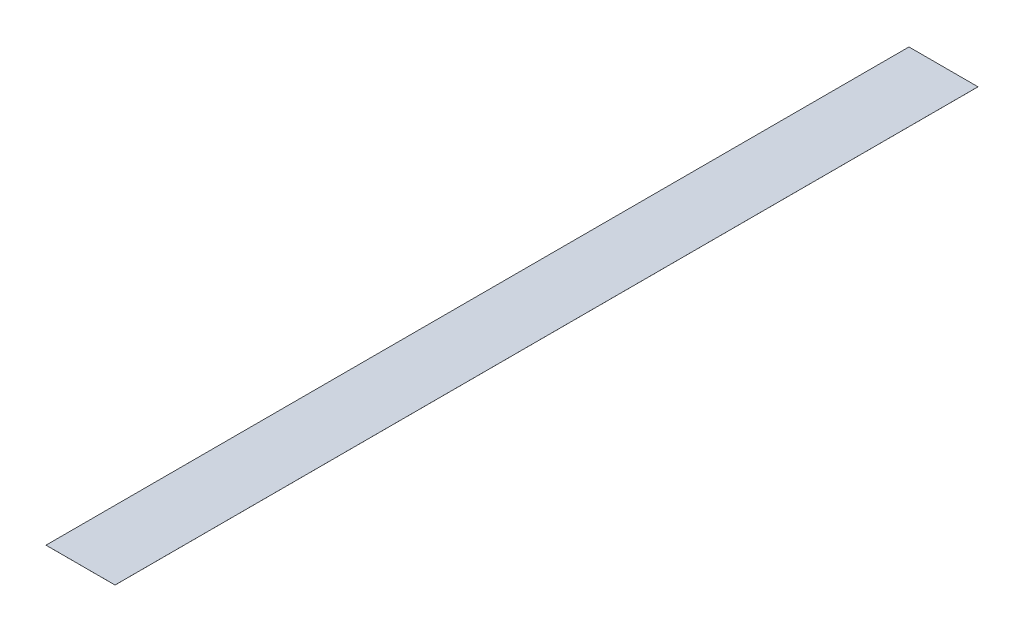
from build123d import *

# Parameters (mm, degrees)
ESBO_O1_W                 = 20
ESBO_O1_H                 = 250
RESSALTO_EXTRUS_O18_DEPTH = 0.01


with BuildPart() as part:
    # Esboço1 → Ressalto-extrusão18 (new body)
    with BuildSketch(Plane(origin=(0, 0, 0), x_dir=(1, 0, 0), z_dir=(0, 1, 0))):
        with Locations((-1681.607696338, 764.365268115)):
            Rectangle(ESBO_O1_W, ESBO_O1_H)
    extrude(amount=RESSALTO_EXTRUS_O18_DEPTH)


solid = part.part
